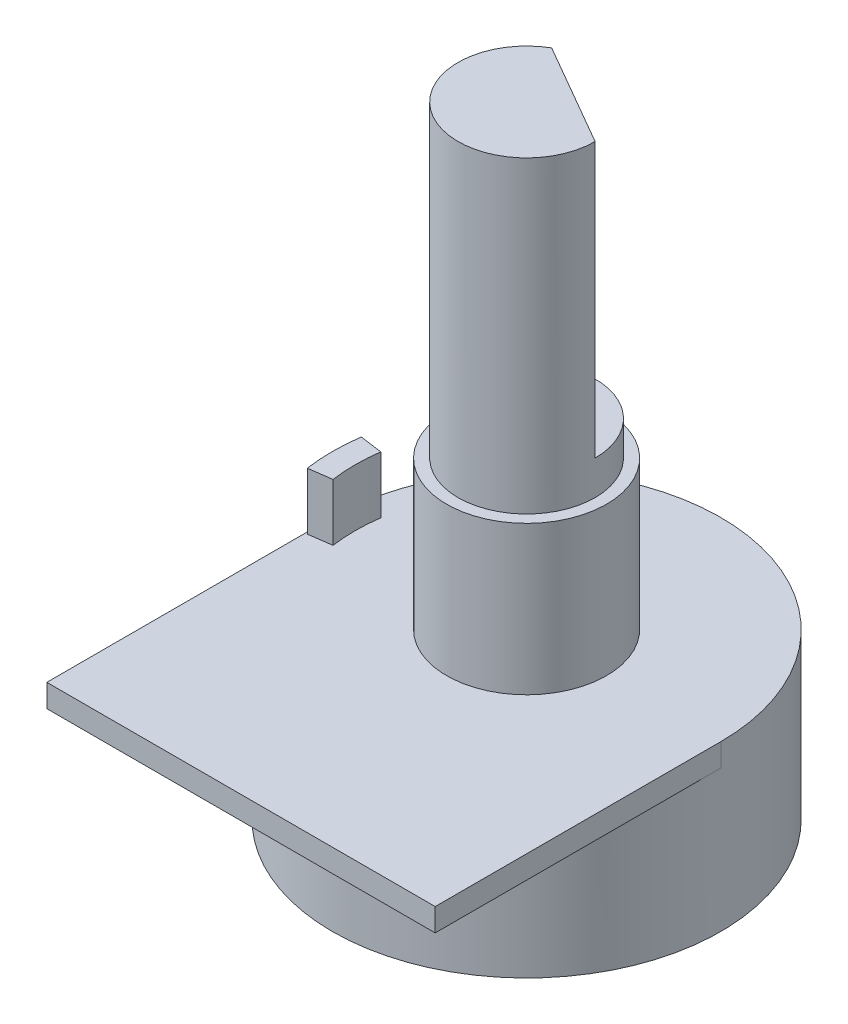
from build123d import *

# Parameters (mm, degrees)
SKETCH_1_R          = 8.5
EXTRUDE_1_DEPTH     = 7.2
EXTRUDE_2_DEPTH     = 2.5
SKETCH_3_R          = 3.5
EXTRUDE_3_DEPTH     = 6.5
SKETCH_4_R          = 3
EXTRUDE_4_DEPTH     = 13.5
CUT_EXTRUDE_START   = -12
CUT_EXTRUDE_1_DEPTH = 12
SKETCH_6_W          = 17
SKETCH_6_H          = 12.5
EXTRUDE_5_DEPTH     = 1


with BuildPart() as part:
    # 草图1 → 凸台-拉伸1 (new body)
    with BuildSketch(Plane(origin=(0, 0, 0), x_dir=(1, 0, 0), z_dir=(0, 1, 0))):
        with Locations(Location((0, 0, 0), (0, 0, 270))):
            Circle(SKETCH_1_R)
    extrude(amount=EXTRUDE_1_DEPTH)

    # 草图2 → 凸台-拉伸2 (add)
    with BuildSketch(Plane(origin=(0, 7.2, 0), x_dir=(1, 0, 0), z_dir=(0, 1, 0))):
        with BuildLine():
            Line((-7.427010516, 1.043798257), (-8.417278584, 1.182971358))
            ThreePointArc((-8.417278584, 1.182971358), (-8.5, 0), (-8.417278584, -1.182971358))
            Line((-8.417278584, -1.182971358), (-7.427010516, -1.043798257))
            ThreePointArc((-7.427010516, -1.043798257), (-7.5, 0), (-7.427010516, 1.043798257))
        make_face()
    extrude(amount=EXTRUDE_2_DEPTH)

    # 草图3 → 凸台-拉伸3 (add)
    with BuildSketch(Plane(origin=(0, 7.2, 0), x_dir=(1, 0, 0), z_dir=(0, 1, 0))):
        with Locations(Location((0, 0, 0), (0, 0, 90))):
            Circle(SKETCH_3_R)
    extrude(amount=EXTRUDE_3_DEPTH)

    # 草图4 → 凸台-拉伸4 (add)
    with BuildSketch(Plane(origin=(0, 13.7, 0), x_dir=(1, 0, 0), z_dir=(0, 1, 0))):
        with Locations(Location((0, 0, 0), (0, 0, 270))):
            Circle(SKETCH_4_R)
    extrude(amount=EXTRUDE_4_DEPTH)

    # 草图5 → 切除-拉伸1 (cut)
    with BuildSketch(Plane(origin=(0, 27.2, 0), x_dir=(1, 0, 0), z_dir=(0, 1, 0)).offset(CUT_EXTRUDE_START)):
        with BuildLine():
            Line((-1.5, 2.598076211), (3, 0))
            ThreePointArc((3, 0), (1.5, 2.598076211), (-1.5, 2.598076211))
        make_face()
    extrude(amount=CUT_EXTRUDE_1_DEPTH, mode=Mode.SUBTRACT)

    # 草图6 → 凸台-拉伸5 (add)
    with BuildSketch(Plane(origin=(0, 7.2, 0), x_dir=(1, 0, 0), z_dir=(0, 1, 0))):
        with Locations((0, -6.25)):
            Rectangle(SKETCH_6_W, SKETCH_6_H)
    extrude(amount=-EXTRUDE_5_DEPTH)


solid = part.part
